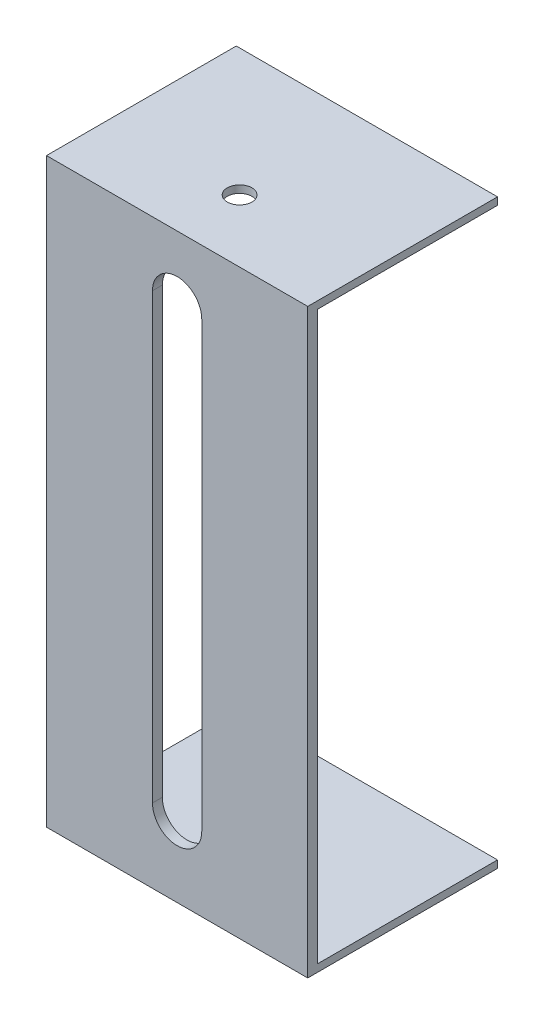
from build123d import *

# Parameters (mm, degrees)
SKETCH1_W           = 90
SKETCH1_H           = 69
SKETCH1_W_2         = 84
SKETCH1_H_2         = 63
BOSS_EXTRUDE1_DEPTH = 3
SKETCH2_W           = 106
SKETCH2_H           = 77
SKETCH2_R           = 5
BOSS_EXTRUDE3_DEPTH = 3
SKETCH3_W           = 230
SKETCH3_H           = 4
BOSS_EXTRUDE4_DEPTH = 106
SKETCH4_W           = 90
SKETCH4_H           = 219
SKETCH4_W_2         = 84
SKETCH4_H_2         = 213
BOSS_EXTRUDE5_DEPTH = 2
SKETCH5_W           = 3
SKETCH5_H           = 77
BOSS_EXTRUDE6_DEPTH = 106
SKETCH6_R           = 5
CUT_EXTRUDE1_DEPTH  = 3
CUT_EXTRUDE2_DEPTH  = 249.270014299


with BuildPart() as part:
    # Sketch1 → Boss-Extrude1 (new body)
    with BuildSketch(Plane(origin=(0, 0, 0), x_dir=(1, 0, 0), z_dir=(0, 1, 0))):
        Rectangle(SKETCH1_W, SKETCH1_H)
        Rectangle(SKETCH1_W_2, SKETCH1_H_2, mode=Mode.SUBTRACT)
    extrude(amount=BOSS_EXTRUDE1_DEPTH)

    # Sketch2 → Boss-Extrude3 (add)
    with BuildSketch(Plane(origin=(0, 3, 0), x_dir=(1, 0, 0), z_dir=(0, 1, 0))):
        Rectangle(SKETCH2_W, SKETCH2_H)
        with Locations(Location((0, -13.15, 0), (0, 0, 270))):
            Circle(SKETCH2_R, mode=Mode.SUBTRACT)
    extrude(amount=BOSS_EXTRUDE3_DEPTH)

    # Sketch3 → Boss-Extrude4 (add)
    with BuildSketch(Plane(origin=(-53, 0, 0), x_dir=(0, -1, 0), z_dir=(-1, 0, 0))):
        with Locations((112, 36.5)):
            Rectangle(SKETCH3_W, SKETCH3_H)
    extrude(amount=-BOSS_EXTRUDE4_DEPTH)

    # Sketch4 → Boss-Extrude5 (add)
    with BuildSketch(Plane(origin=(0, 0, 34.5), x_dir=(1, 0, 0), z_dir=(0, 0, -1))):
        with Locations((0, 109.5)):
            Rectangle(SKETCH4_W, SKETCH4_H)
        with Locations((0, 109.5)):
            Rectangle(SKETCH4_W_2, SKETCH4_H_2, mode=Mode.SUBTRACT)
    extrude(amount=BOSS_EXTRUDE5_DEPTH)

    # Sketch5 → Boss-Extrude6 (add)
    with BuildSketch(Plane(origin=(-53, 0, 0), x_dir=(0, -1, 0), z_dir=(-1, 0, 0))):
        with Locations((228.5, 0)):
            Rectangle(SKETCH5_W, SKETCH5_H)
    extrude(amount=-BOSS_EXTRUDE6_DEPTH)

    # Sketch6 → Cut-Extrude1 (cut)
    with BuildSketch(Plane.XZ.offset(230)):
        with Locations(Location((0, 13.15, 0), (0, 0, 90))):
            Circle(SKETCH6_R)
    extrude(amount=-CUT_EXTRUDE1_DEPTH, mode=Mode.SUBTRACT)

    # Sketch7 → Cut-Extrude2 (cut, through all)
    with BuildSketch(Plane.XY.offset(38.5)):
        with BuildLine():
            Line((10, -20), (10, -200))
            ThreePointArc((10, -200), (0, -210), (-10, -200))
            Line((-10, -200), (-10, -20))
            ThreePointArc((-10, -20), (0, -10), (10, -20))
        make_face()
    extrude(amount=-CUT_EXTRUDE2_DEPTH, mode=Mode.SUBTRACT)


solid = part.part
